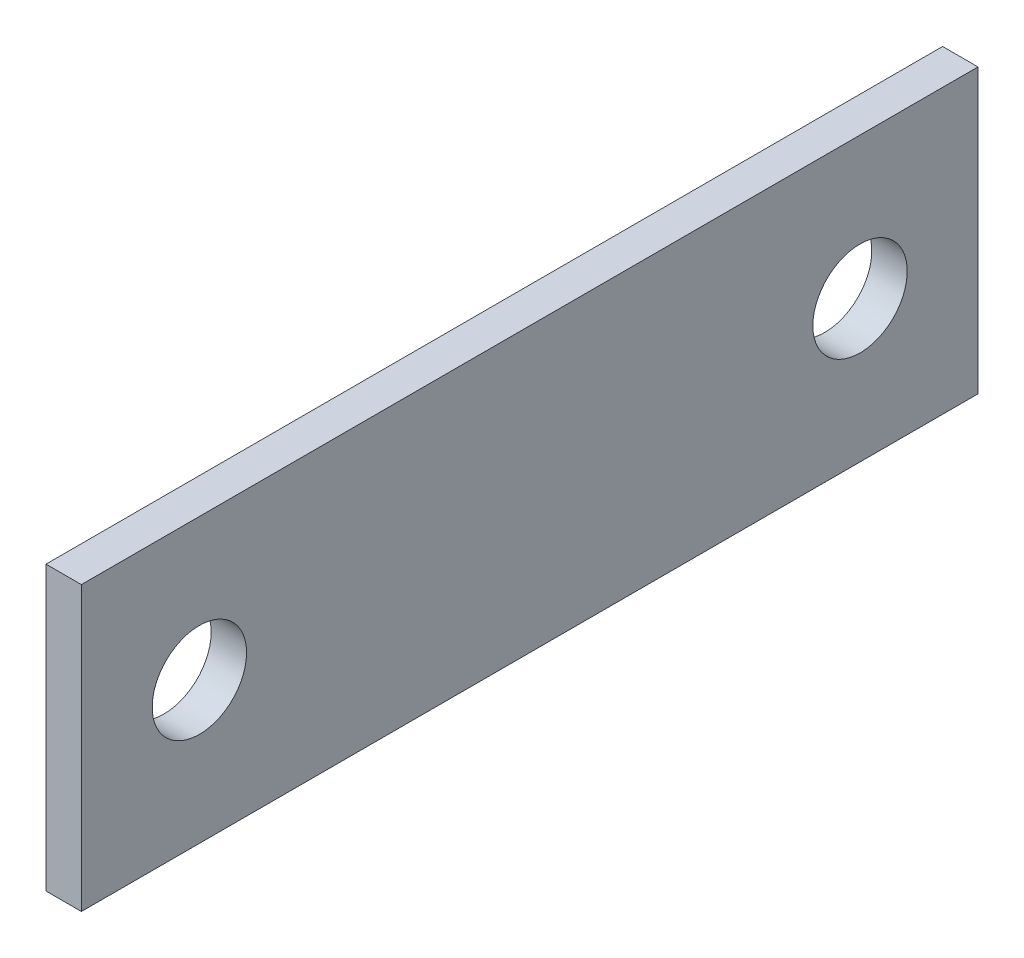
from build123d import *

# Parameters (mm, degrees)
ESBO_O1_W                = 38
ESBO_O1_H                = 12
ESBO_O1_R                = 2
RESSALTO_EXTRUS_O1_DEPTH = 1.5


with BuildPart() as part:
    # Esboço1 → Ressalto-extrusão1 (new body)
    with BuildSketch(Plane(origin=(0, 0, 0), x_dir=(0, 0, -1), z_dir=(1, 0, 0))):
        Rectangle(ESBO_O1_W, ESBO_O1_H)
        with Locations((-14, 0)):
            Circle(ESBO_O1_R, mode=Mode.SUBTRACT)
        with Locations(Location((14, 0, 0), (0, 0, 180))):
            Circle(ESBO_O1_R, mode=Mode.SUBTRACT)
    extrude(amount=RESSALTO_EXTRUS_O1_DEPTH)


solid = part.part
